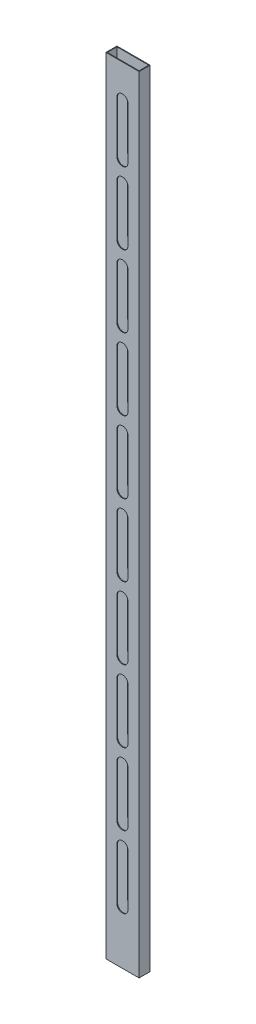
from build123d import *

# Parameters (mm, degrees)
SKETCH1_W           = 76.2
SKETCH1_H           = 25.4
SKETCH1_W_2         = 73.025
SKETCH1_H_2         = 22.225
BOSS_EXTRUDE1_DEPTH = 1803.4
CUT_EXTRUDE1_DEPTH  = 1806.187846181


with BuildPart() as part:
    # Sketch1 → Boss-Extrude1 (new body)
    with BuildSketch(Plane(origin=(0, 0, 0), x_dir=(1, 0, 0), z_dir=(0, 1, 0))):
        with Locations((-38.1, 12.7)):
            Rectangle(SKETCH1_W, SKETCH1_H)
        with Locations((-38.1, 12.7)):
            Rectangle(SKETCH1_W_2, SKETCH1_H_2, mode=Mode.SUBTRACT)
    extrude(amount=BOSS_EXTRUDE1_DEPTH)

    # Sketch2 → Cut-Extrude1 (cut, through all)
    with BuildSketch(Plane.XY):
        with BuildLine():
            Line((-25.4, 1727.2), (-25.4, 1608.697688474))
            ThreePointArc((-25.4, 1608.697688474), (-38.1, 1595.997688474), (-50.8, 1608.697688474))
            Line((-50.8, 1608.697688474), (-50.8, 1727.2))
            ThreePointArc((-50.8, 1727.2), (-38.1, 1739.9), (-25.4, 1727.2))
        make_face()
        with BuildLine():
            Line((-25.4, 1562.1), (-25.4, 1443.597688474))
            ThreePointArc((-25.4, 1443.597688474), (-38.1, 1430.897688474), (-50.8, 1443.597688474))
            Line((-50.8, 1443.597688474), (-50.8, 1562.1))
            ThreePointArc((-50.8, 1562.1), (-38.1, 1574.8), (-25.4, 1562.1))
        make_face()
        with BuildLine():
            Line((-25.4, 1397), (-25.4, 1278.497688474))
            ThreePointArc((-25.4, 1278.497688474), (-38.1, 1265.797688474), (-50.8, 1278.497688474))
            Line((-50.8, 1278.497688474), (-50.8, 1397))
            ThreePointArc((-50.8, 1397), (-38.1, 1409.7), (-25.4, 1397))
        make_face()
        with BuildLine():
            Line((-25.4, 1231.9), (-25.4, 1113.397688474))
            ThreePointArc((-25.4, 1113.397688474), (-38.1, 1100.697688474), (-50.8, 1113.397688474))
            Line((-50.8, 1113.397688474), (-50.8, 1231.9))
            ThreePointArc((-50.8, 1231.9), (-38.1, 1244.6), (-25.4, 1231.9))
        make_face()
        with BuildLine():
            Line((-25.4, 1066.8), (-25.4, 948.297688474))
            ThreePointArc((-25.4, 948.297688474), (-38.1, 935.597688474), (-50.8, 948.297688474))
            Line((-50.8, 948.297688474), (-50.8, 1066.8))
            ThreePointArc((-50.8, 1066.8), (-38.1, 1079.5), (-25.4, 1066.8))
        make_face()
        with BuildLine():
            Line((-25.4, 901.7), (-25.4, 783.197688474))
            ThreePointArc((-25.4, 783.197688474), (-38.1, 770.497688474), (-50.8, 783.197688474))
            Line((-50.8, 783.197688474), (-50.8, 901.7))
            ThreePointArc((-50.8, 901.7), (-38.1, 914.4), (-25.4, 901.7))
        make_face()
        with BuildLine():
            Line((-25.4, 736.6), (-25.4, 618.097688474))
            ThreePointArc((-25.4, 618.097688474), (-38.1, 605.397688474), (-50.8, 618.097688474))
            Line((-50.8, 618.097688474), (-50.8, 736.6))
            ThreePointArc((-50.8, 736.6), (-38.1, 749.3), (-25.4, 736.6))
        make_face()
        with BuildLine():
            Line((-25.4, 571.5), (-25.4, 452.997688474))
            ThreePointArc((-25.4, 452.997688474), (-38.1, 440.297688474), (-50.8, 452.997688474))
            Line((-50.8, 452.997688474), (-50.8, 571.5))
            ThreePointArc((-50.8, 571.5), (-38.1, 584.2), (-25.4, 571.5))
        make_face()
        with BuildLine():
            Line((-25.4, 406.4), (-25.4, 287.897688474))
            ThreePointArc((-25.4, 287.897688474), (-38.1, 275.197688474), (-50.8, 287.897688474))
            Line((-50.8, 287.897688474), (-50.8, 406.4))
            ThreePointArc((-50.8, 406.4), (-38.1, 419.1), (-25.4, 406.4))
        make_face()
        with BuildLine():
            Line((-25.4, 241.3), (-25.4, 122.797688474))
            ThreePointArc((-25.4, 122.797688474), (-38.1, 110.097688474), (-50.8, 122.797688474))
            Line((-50.8, 122.797688474), (-50.8, 241.3))
            ThreePointArc((-50.8, 241.3), (-38.1, 254), (-25.4, 241.3))
        make_face()
    extrude(amount=-CUT_EXTRUDE1_DEPTH, mode=Mode.SUBTRACT)


solid = part.part
